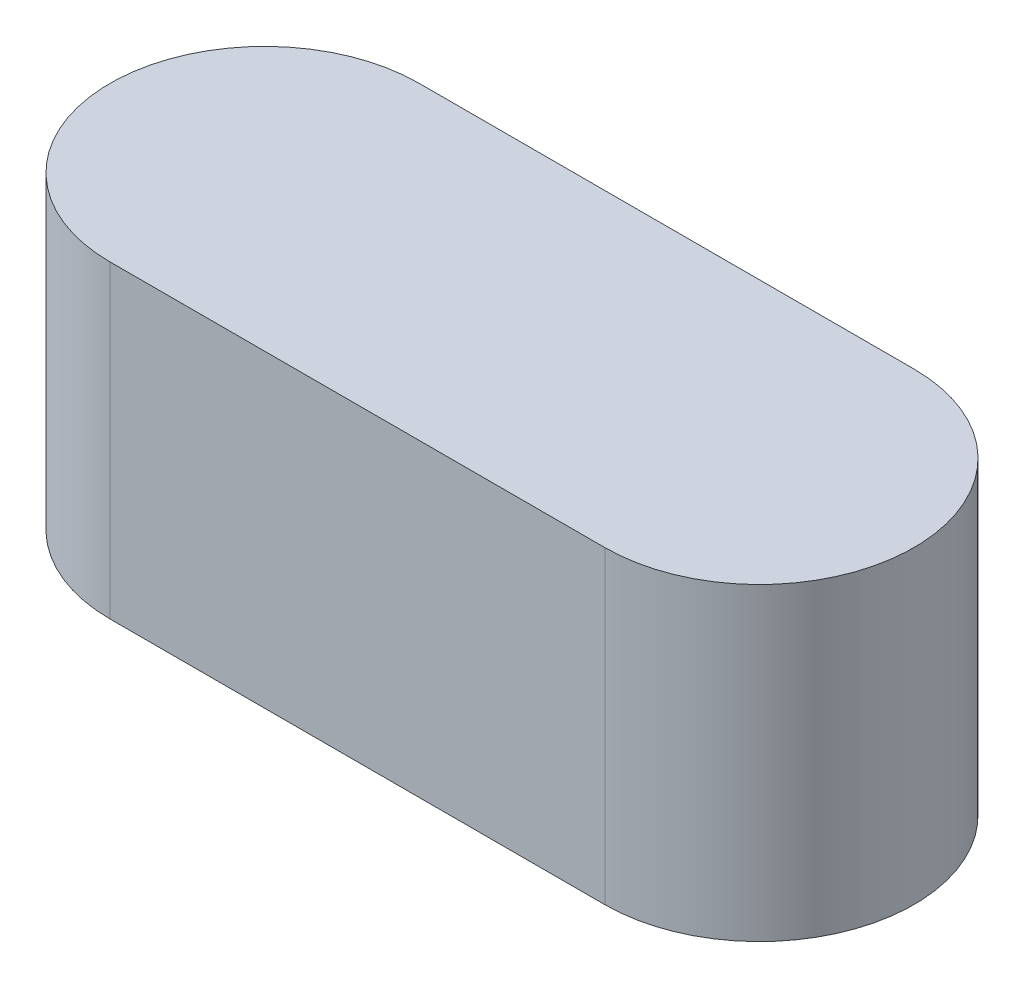
from build123d import *

# Parameters (mm, degrees)
EXTRUDE_1_DEPTH = 5


with BuildPart() as part:
    # 草图1 → 凸台-拉伸1 (new body)
    with BuildSketch(Plane(origin=(0, 0, 0), x_dir=(1, 0, 0), z_dir=(0, 1, 0))):
        with BuildLine():
            Line((0, 2.5), (8, 2.5))
            ThreePointArc((8, 2.5), (10.5, 0), (8, -2.5))
            Line((8, -2.5), (0, -2.5))
            ThreePointArc((0, -2.5), (-2.5, 0), (0, 2.5))
        make_face()
    extrude(amount=EXTRUDE_1_DEPTH)


solid = part.part
